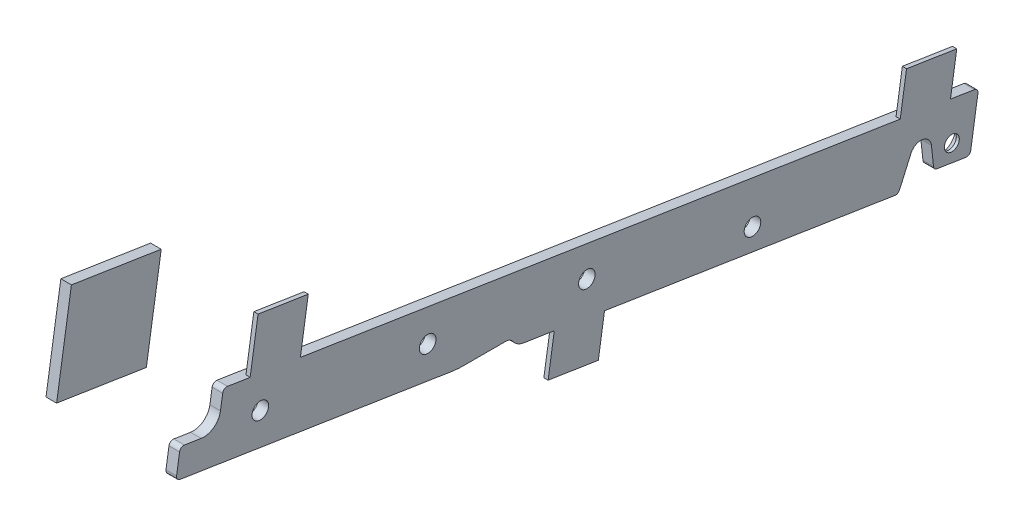
from build123d import *

# Parameters (mm, degrees)
SKETCH1_R           = 2.4892
BOSS_EXTRUDE1_DEPTH = 1.5875
FILLET1_R           = 5.08
FILLET2_R           = 25.4
FILLET3_R           = 5.08
FILLET4_R           = 1.27
BOSS_EXTRUDE2_DEPTH = 1.27
BOSS_EXTRUDE3_DEPTH = 3.175


with BuildPart() as part:
    # Sketch1 → Boss-Extrude1 (new, symmetric)
    with BuildSketch(Plane(origin=(0, 0, 0), x_dir=(0, 0, -1), z_dir=(1, 0, 0))):
        with BuildLine():
            Line((-233.577951119, 32.983434854), (-149.119868942, 19.812))
            Line((-149.119868942, 19.812), (-134.62, 19.812))
            ThreePointArc((-134.62, 19.812), (-132.783053242, 19.026202556), (-132.082695513, 17.155013077))
            Line((-132.082695513, 17.155013077), (-16.958288608, -0.798906627))
            Line((-16.958288608, -0.798906627), (-13.131238228, 7.851990013))
            ThreePointArc((-13.131238228, 7.851990013), (-9.697725885, 9.726800552), (-6.99813958, 6.895518978))
            Line((-6.99813958, 6.895518978), (-6.268088645, 0.104634039))
            Line((-6.268088645, 0.104634039), (4.604139182, -1.590915242))
            Line((4.604139182, -1.590915242), (7.148161285, 14.721903384))
            Line((7.148161285, 14.721903384), (-219.349051182, 50.044671814))
            Line((-219.349051182, 50.044671814), (-220.992880849, 39.504081317))
            Line((-220.992880849, 39.504081317), (-232.286370667, 41.265327388))
            Line((-232.286370667, 41.265327388), (-233.577951119, 32.983434854))
        make_face()
        with Locations((-110.329119322, 23.8125)):
            Circle(SKETCH1_R, mode=Mode.SUBTRACT)
        with Locations((-60.6679, 12.573)):
            Circle(SKETCH1_R, mode=Mode.SUBTRACT)
        with Locations((-208.268434221, 38.676490219)):
            Circle(SKETCH1_R, mode=Mode.SUBTRACT)
        with Locations((-158.07514614, 30.848729903)):
            Circle(SKETCH1_R, mode=Mode.SUBTRACT)
    extrude(amount=BOSS_EXTRUDE1_DEPTH, both=True)

    # Fillet1
    fillet1_edges = [part.edges().sort_by_distance(p)[0] for p in [
        (0, 39.504081317, 220.992880849),
    ]]
    fillet(fillet1_edges, radius=FILLET1_R)

    # Fillet2
    fillet2_edges = [part.edges().sort_by_distance(p)[0] for p in [
        (0, 19.812, 149.119868942),
    ]]
    fillet(fillet2_edges, radius=FILLET2_R)

    # Fillet3
    fillet3_edges = [part.edges().sort_by_distance(p)[0] for p in [
        (0, 17.155013077, 132.082695513),
    ]]
    fillet(fillet3_edges, radius=FILLET3_R)

    # Fillet4
    fillet4_edges = [part.edges().sort_by_distance(p)[0] for p in [
        (0, 41.265327388, 232.286370667),
        (0, 50.044671814, 219.349051182),
        (0, 14.721903384, -7.148161285),
        (0, -1.590915242, -4.604139182),
        (0, 0.104634039, 6.268088645),
        (0, -0.798906627, 16.958288608),
        (0, 32.983434854, 233.577951119),
    ]]
    fillet(fillet4_edges, radius=FILLET4_R)

    # Sketch3 → CSK for #8 Oval Head Machine Screw1 (revolve, cut)
    with BuildSketch(Plane(origin=(-1.5875, 4.406883606, 0.887245796), x_dir=(0, 0, 1), z_dir=(0, 1, 0))):
        Polygon((0, 0), (0, 3.175), (2.2479, 3.175), (2.2479, 2.26450021), (4.2164, 0), align=None)
    revolve(axis=Axis((-7.9375, 4.406883606, 0.887245796), (1, 0, 0)), mode=Mode.SUBTRACT)

    # Sketch5 → Boss-Extrude2 (add)
    with BuildSketch(Plane(origin=(1.5875, 0, 0), x_dir=(0, 0, -1), z_dir=(1, 0, 0))):
        Polygon((-211.309449187, 48.790877136), (-196.251462762, 46.442549041), (-193.874976982, 61.681088617), (-208.932963407, 64.029416712), align=None)
        Polygon((-16.348177372, 18.386212187), (-1.290190948, 16.037884092), (0.601235673, 28.166119681), (-14.456750751, 30.514447776), align=None)
        Polygon((-120.099402783, 15.286190633), (-105.041416359, 12.937862538), (-106.901320308, 1.01175712), (-121.959306732, 3.360085215), align=None)
    extrude(amount=-BOSS_EXTRUDE2_DEPTH)


with BuildPart() as body_2:
    # Sketch6 → Boss-Extrude3 (new body)
    with BuildSketch(Plane(origin=(1.5875, 0, 0), x_dir=(0, 0, -1), z_dir=(1, 0, 0))):
        Polygon((-237.983488244, 95.40736612), (-242.42694337, 66.914973125), (-269.360010559, 71.115247756), (-264.916555433, 99.60764075), align=None)
    extrude(amount=-BOSS_EXTRUDE3_DEPTH)


solid = Compound([part.part, body_2.part])
